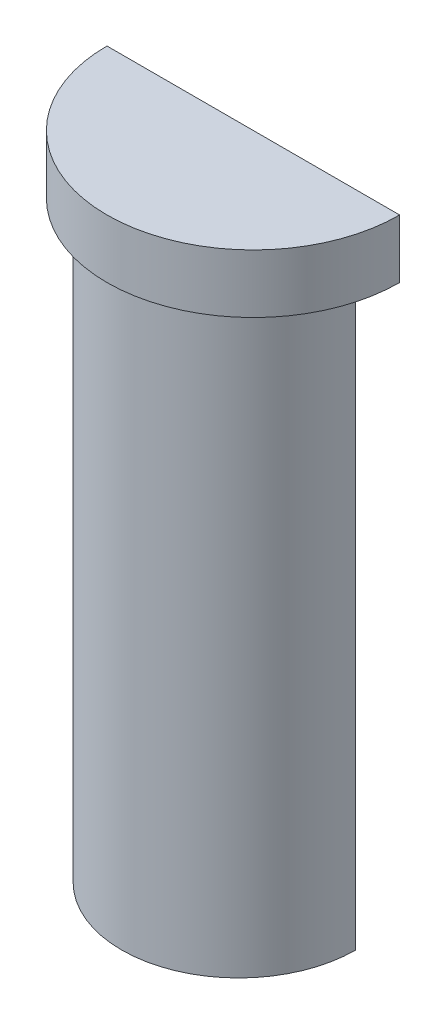
from build123d import *

# Parameters (mm, degrees)
EXTRUDE_1_DEPTH = 5
EXTRUDE_2_DEPTH = 1


with BuildPart() as part:
    # 草图1 → 凸台-拉伸1 (new, symmetric)
    with BuildSketch(Plane(origin=(0, 0, 0), x_dir=(1, 0, 0), z_dir=(0, 1, 0))):
        with BuildLine():
            Line((0, 0), (4, 0))
            ThreePointArc((4, 0), (2, -2), (0, 0))
        make_face()
    extrude(amount=EXTRUDE_1_DEPTH, both=True)

    # 草图2 → 凸台-拉伸2 (add)
    with BuildSketch(Plane(origin=(0, 5, 0), x_dir=(1, 0, 0), z_dir=(0, 1, 0))):
        with BuildLine():
            Line((-0.5, 0.25), (4.5, 0.25))
            ThreePointArc((4.5, 0.25), (2, -2.25), (-0.5, 0.25))
        make_face()
    extrude(amount=EXTRUDE_2_DEPTH)


solid = part.part
